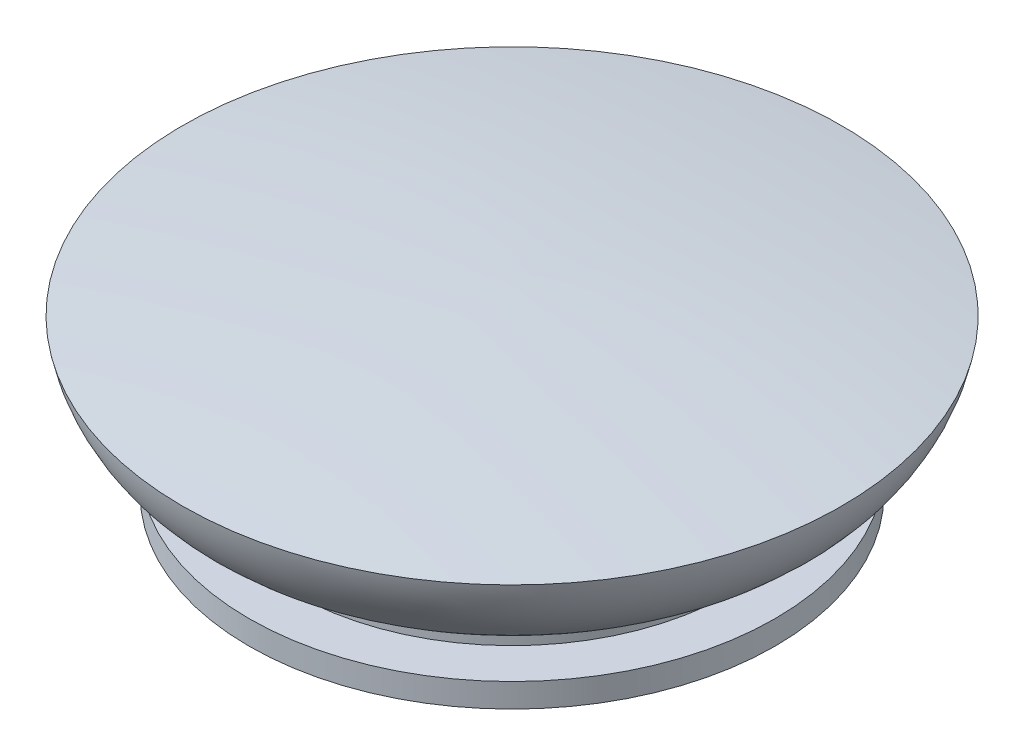
from build123d import *


with BuildPart() as part:
    # Sketch1 → Revolve1 (revolve)
    with BuildSketch(Plane.XY, mode=Mode.PRIVATE) as revolve1_sk:
        with BuildLine():
            Line((0, 0), (-47.875, 0))
            Line((-47.875, 0), (-47.875, 4.35))
            Line((-47.875, 4.35), (-39.875, 4.35))
            Line((-39.875, 4.35), (-39.875, 9.35))
            ThreePointArc((-39.875, 9.35), (-53.009905732, 15.462614113), (-60, 28.152310013))
            ThreePointArc((-60, 28.152310013), (-30.076924173, 31.528247731), (0, 33))
            Line((0, 33), (0, 28.152310013))
            Line((0, 28.152310013), (0, 0))
        make_face()
    revolve(revolve1_sk.sketch.rotate(Axis((0, 28.152310013, 0), (0, -1, 0)), 270), axis=Axis((0, 28.152310013, 0), (0, -1, 0)))


solid = part.part
